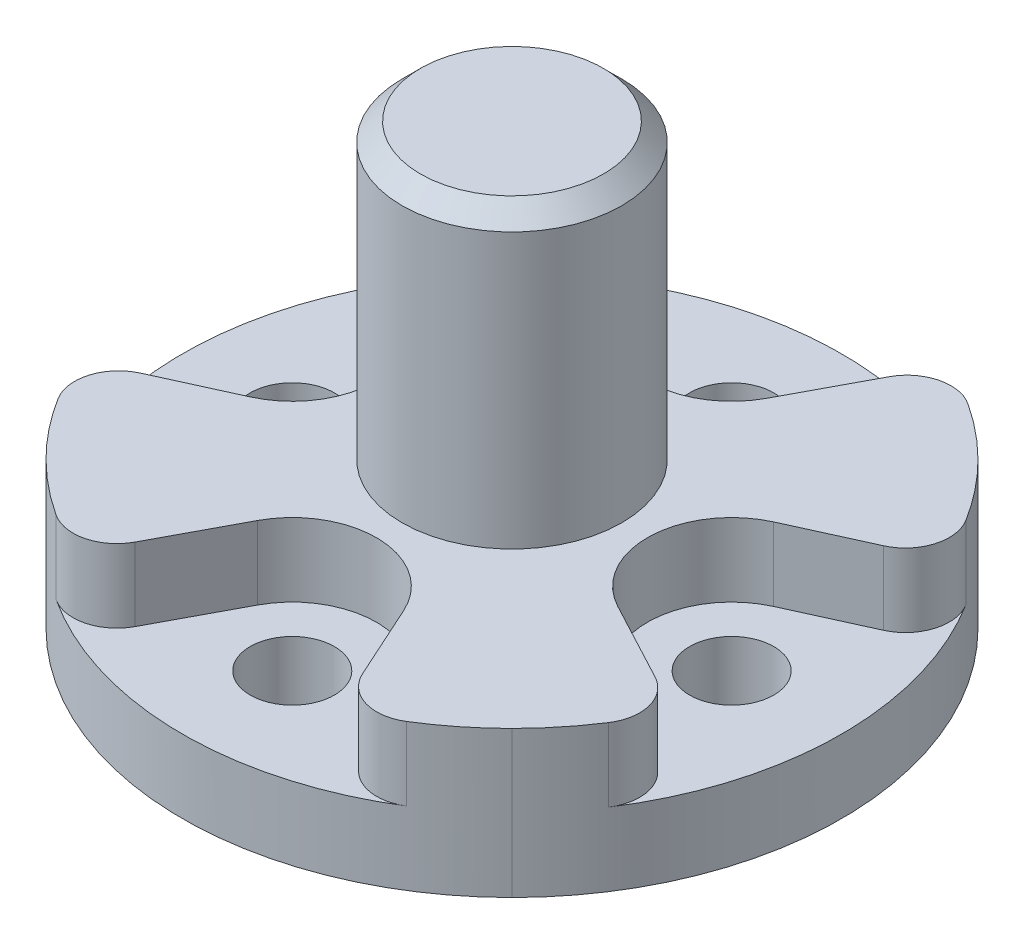
from build123d import *

# Parameters (mm, degrees)
SKETCH_1_R          = 1.15
EXTRUDE_1_DEPTH     = 4
SKETCH_2_R          = 3
EXTRUDE_2_DEPTH     = 8
CHAMFER_1_SIZE      = 0.5
CUT_EXTRUDE_START   = -2
CUT_EXTRUDE_2_DEPTH = 2
FILLET_1_R          = 1.2


with BuildPart() as part:
    # 草图1 → 凸台-拉伸1 (new body)
    with BuildSketch(Plane(origin=(0, 0, 0), x_dir=(1, 0, 0), z_dir=(0, 1, 0))):
        with BuildLine():
            ThreePointArc((-6.363461011, -6.362461011), (0, -8.998), (6.363461011, -6.362461011))
            ThreePointArc((6.363461011, -6.362461011), (8.314051085, -3.442824248), (8.999, 0.001))
            ThreePointArc((8.999, 0.001), (8.314051085, 3.444824248), (6.363461011, 6.364461011))
            ThreePointArc((6.363461011, 6.364461011), (0, 9), (-6.363461011, 6.364461011))
            ThreePointArc((-6.363461011, 6.364461011), (-8.999, 0.001), (-6.363461011, -6.362461011))
        make_face()
        with Locations(Location((-6, 0, 0), (0, 0, 270))):
            Circle(SKETCH_1_R, mode=Mode.SUBTRACT)
        with Locations(Location((0, -6, 0), (0, 0, 270))):
            Circle(SKETCH_1_R, mode=Mode.SUBTRACT)
        with Locations(Location((6, 0, 0), (0, 0, 270))):
            Circle(SKETCH_1_R, mode=Mode.SUBTRACT)
        with Locations(Location((0, 6, 0), (0, 0, 270))):
            Circle(SKETCH_1_R, mode=Mode.SUBTRACT)
    extrude(amount=EXTRUDE_1_DEPTH)

    # 草图2 → 凸台-拉伸2 (add)
    with BuildSketch(Plane(origin=(0, 4, 0), x_dir=(1, 0, 0), z_dir=(0, 1, 0))):
        with Locations(Location((0, 0, 0), (0, 0, 270))):
            Circle(SKETCH_2_R)
    extrude(amount=EXTRUDE_2_DEPTH)

    # 倒角1
    chamfer_1_edges = [part.edges().sort_by_distance(p)[0] for p in [
        (0, 12, -3),
    ]]
    chamfer(chamfer_1_edges, length=CHAMFER_1_SIZE)

    # 草图4 → 切除-拉伸2 (cut)
    with BuildSketch(Plane(origin=(0, 4, 0), x_dir=(1, 0, 0), z_dir=(0, 1, 0)).offset(CUT_EXTRUDE_START)):
        with BuildLine():
            Line((5.049644753, 2.094474852), (8.268186553, 3.554868652))
            ThreePointArc((8.268186553, 3.554868652), (8.99927597, -0.114157891), (8.175351882, -3.763458729))
            Line((8.175351882, -3.763458729), (4.91929542, -2.030290031))
            ThreePointArc((4.91929542, -2.030290031), (3.701147604, 0.072647504), (5.049644753, 2.094474852))
        make_face()
        with BuildLine():
            Line((2.094474852, -5.049644753), (3.554868652, -8.268186553))
            ThreePointArc((3.554868652, -8.268186553), (-0.114157891, -8.99927597), (-3.763458729, -8.175351882))
            Line((-3.763458729, -8.175351882), (-2.030290031, -4.91929542))
            ThreePointArc((-2.030290031, -4.91929542), (0.072647504, -3.701147604), (2.094474852, -5.049644753))
        make_face()
        with BuildLine():
            Line((-5.049644753, -2.094474852), (-8.268186553, -3.554868652))
            ThreePointArc((-8.268186553, -3.554868652), (-8.99927597, 0.114157891), (-8.175351882, 3.763458729))
            Line((-8.175351882, 3.763458729), (-4.91929542, 2.030290031))
            ThreePointArc((-4.91929542, 2.030290031), (-3.701147604, -0.072647504), (-5.049644753, -2.094474852))
        make_face()
        with BuildLine():
            Line((-2.094474852, 5.049644753), (-3.554868652, 8.268186553))
            ThreePointArc((-3.554868652, 8.268186553), (0.114157891, 8.99927597), (3.763458729, 8.175351882))
            Line((3.763458729, 8.175351882), (2.030290031, 4.91929542))
            ThreePointArc((2.030290031, 4.91929542), (-0.072647504, 3.701147604), (-2.094474852, 5.049644753))
        make_face()
    extrude(amount=CUT_EXTRUDE_2_DEPTH, mode=Mode.SUBTRACT)

    # 圆角1
    fillet_1_edges = [part.edges().sort_by_distance(p)[0] for p in [
        (-3.762603645, 3, 8.173745459),
        (3.554109286, 3, 8.266512997),
        (-8.174918344, 3, -3.763227961),
        (-8.266990018, 3, 3.554325732),
        (-3.554868652, 3, -8.268186553),
        (3.763458729, 3, -8.175351882),
        (8.174178942, 3, 3.762834384),
        (8.267709465, 3, -3.554652176),
    ]]
    fillet(fillet_1_edges, radius=FILLET_1_R)


solid = part.part
